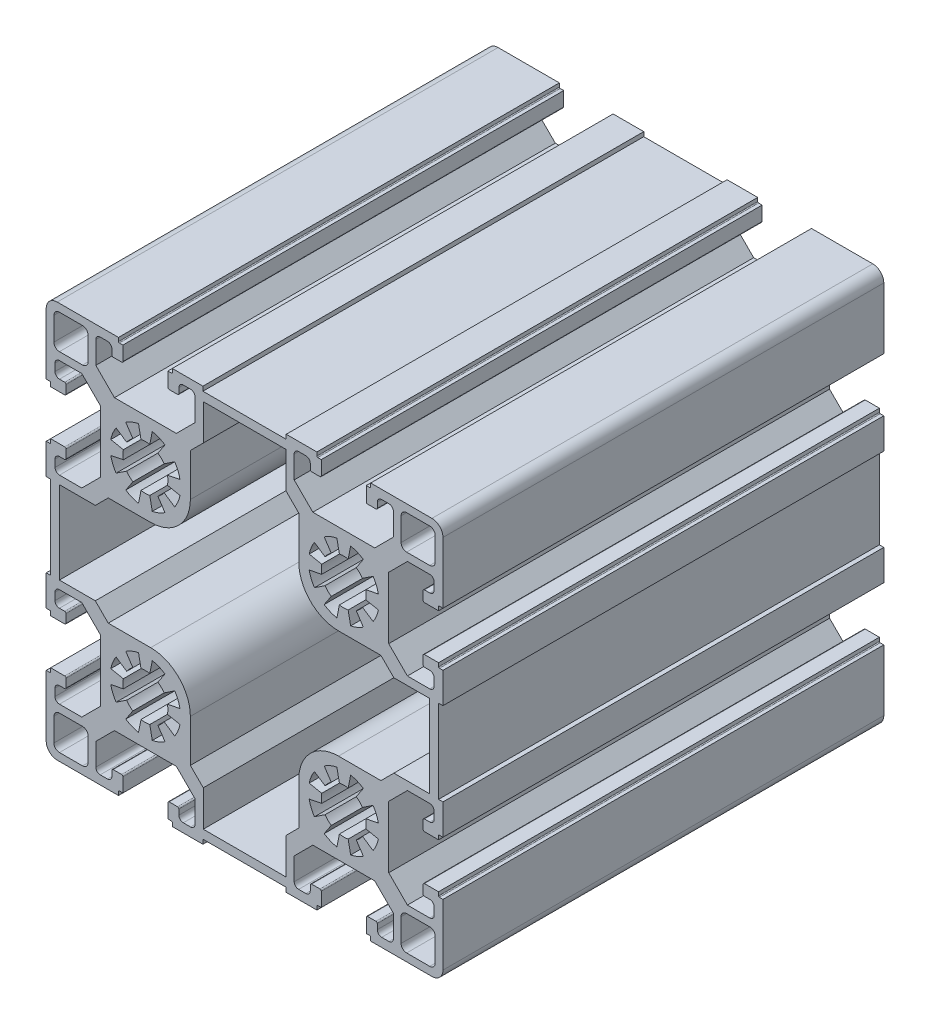
from build123d import *

# Parameters (mm, degrees)
EXTRUDE_1_DEPTH = 100


with BuildPart() as part:
    # 草图1 → 凸台-拉伸1 (new body)
    with BuildSketch(Plane.XY):
        with BuildLine():
            Line((-29.082808051, 43.33457223), (-42.982808051, 43.33457223))
            ThreePointArc((-42.982808051, 43.33457223), (-44.750575003, 42.602339183), (-45.482808051, 40.83457223))
            Line((-45.482808051, 40.83457223), (-45.482808051, 26.93457223))
            Line((-45.482808051, 26.93457223), (-44.682808051, 26.93457223))
            ThreePointArc((-44.682808051, 26.93457223), (-44.541386694, 26.875993586), (-44.482808051, 26.73457223))
            Line((-44.482808051, 26.73457223), (-44.482808051, 25.93457223))
            Line((-44.482808051, 25.93457223), (-41.282808051, 25.93457223))
            ThreePointArc((-41.282808051, 25.93457223), (-41.070676016, 26.022440196), (-40.982808051, 26.23457223))
            Line((-40.982808051, 26.23457223), (-40.982808051, 28.13457223))
            ThreePointArc((-40.982808051, 28.13457223), (-41.070676016, 28.346704264), (-41.282808051, 28.43457223))
            Line((-41.282808051, 28.43457223), (-42.482808051, 28.43457223))
            ThreePointArc((-42.482808051, 28.43457223), (-43.189914832, 28.727465449), (-43.482808051, 29.43457223))
            Line((-43.482808051, 29.43457223), (-43.482808051, 31.08457223))
            ThreePointArc((-43.482808051, 31.08457223), (-43.189914832, 31.791679011), (-42.482808051, 32.08457223))
            Line((-42.482808051, 32.08457223), (-37.414788566, 32.08457223))
            Line((-37.414788566, 32.08457223), (-33.182808051, 27.852591715))
            Line((-33.182808051, 27.852591715), (-33.182808051, 13.816552745))
            Line((-33.182808051, 13.816552745), (-37.414788566, 9.58457223))
            Line((-37.414788566, 9.58457223), (-42.482808051, 9.58457223))
            ThreePointArc((-42.482808051, 9.58457223), (-43.189914832, 9.877465449), (-43.482808051, 10.58457223))
            Line((-43.482808051, 10.58457223), (-43.482808051, 12.23457223))
            ThreePointArc((-43.482808051, 12.23457223), (-43.189914832, 12.941679011), (-42.482808051, 13.23457223))
            Line((-42.482808051, 13.23457223), (-41.282808051, 13.23457223))
            ThreePointArc((-41.282808051, 13.23457223), (-41.070676016, 13.322440196), (-40.982808051, 13.53457223))
            Line((-40.982808051, 13.53457223), (-40.982808051, 15.43457223))
            ThreePointArc((-40.982808051, 15.43457223), (-41.070676016, 15.646704264), (-41.282808051, 15.73457223))
            Line((-41.282808051, 15.73457223), (-44.482808051, 15.73457223))
            Line((-44.482808051, 15.73457223), (-44.482808051, 14.93457223))
            ThreePointArc((-44.482808051, 14.93457223), (-44.541386694, 14.793150874), (-44.682808051, 14.73457223))
            Line((-44.682808051, 14.73457223), (-45.482808051, 14.73457223))
            Line((-45.482808051, 14.73457223), (-45.482808051, 7.78457223))
            Line((-45.482808051, 7.78457223), (-44.482808051, 7.78457223))
            Line((-44.482808051, 7.78457223), (-44.482808051, -11.11542777))
            Line((-44.482808051, -11.11542777), (-45.482808051, -11.11542777))
            Line((-45.482808051, -11.11542777), (-45.482808051, -18.06542777))
            Line((-45.482808051, -18.06542777), (-44.682808051, -18.06542777))
            ThreePointArc((-44.682808051, -18.06542777), (-44.541386694, -18.124006414), (-44.482808051, -18.26542777))
            Line((-44.482808051, -18.26542777), (-44.482808051, -19.06542777))
            Line((-44.482808051, -19.06542777), (-41.282808051, -19.06542777))
            ThreePointArc((-41.282808051, -19.06542777), (-41.070676016, -18.977559804), (-40.982808051, -18.76542777))
            Line((-40.982808051, -18.76542777), (-40.982808051, -16.86542777))
            ThreePointArc((-40.982808051, -16.86542777), (-41.070676016, -16.653295736), (-41.282808051, -16.56542777))
            Line((-41.282808051, -16.56542777), (-42.482808051, -16.56542777))
            ThreePointArc((-42.482808051, -16.56542777), (-43.189914832, -16.272534551), (-43.482808051, -15.56542777))
            Line((-43.482808051, -15.56542777), (-43.482808051, -13.91542777))
            ThreePointArc((-43.482808051, -13.91542777), (-43.189914832, -13.208320989), (-42.482808051, -12.91542777))
            Line((-42.482808051, -12.91542777), (-37.414788566, -12.91542777))
            Line((-37.414788566, -12.91542777), (-33.182808051, -17.147408285))
            Line((-33.182808051, -17.147408285), (-33.182808051, -31.183447255))
            Line((-33.182808051, -31.183447255), (-37.414788566, -35.41542777))
            Line((-37.414788566, -35.41542777), (-42.482808051, -35.41542777))
            ThreePointArc((-42.482808051, -35.41542777), (-43.189914832, -35.122534551), (-43.482808051, -34.41542777))
            Line((-43.482808051, -34.41542777), (-43.482808051, -32.76542777))
            ThreePointArc((-43.482808051, -32.76542777), (-43.189914832, -32.058320989), (-42.482808051, -31.76542777))
            Line((-42.482808051, -31.76542777), (-41.282808051, -31.76542777))
            ThreePointArc((-41.282808051, -31.76542777), (-41.070676016, -31.677559804), (-40.982808051, -31.46542777))
            Line((-40.982808051, -31.46542777), (-40.982808051, -29.56542777))
            ThreePointArc((-40.982808051, -29.56542777), (-41.070676016, -29.353295736), (-41.282808051, -29.26542777))
            Line((-41.282808051, -29.26542777), (-44.482808051, -29.26542777))
            Line((-44.482808051, -29.26542777), (-44.482808051, -30.06542777))
            ThreePointArc((-44.482808051, -30.06542777), (-44.541386694, -30.206849126), (-44.682808051, -30.26542777))
            Line((-44.682808051, -30.26542777), (-45.482808051, -30.26542777))
            Line((-45.482808051, -30.26542777), (-45.482808051, -44.16542777))
            ThreePointArc((-45.482808051, -44.16542777), (-44.750575003, -45.933194723), (-42.982808051, -46.66542777))
            Line((-42.982808051, -46.66542777), (-29.082808051, -46.66542777))
            Line((-29.082808051, -46.66542777), (-29.082808051, -45.86542777))
            ThreePointArc((-29.082808051, -45.86542777), (-29.024229407, -45.724006414), (-28.882808051, -45.66542777))
            Line((-28.882808051, -45.66542777), (-28.082808051, -45.66542777))
            Line((-28.082808051, -45.66542777), (-28.082808051, -42.46542777))
            ThreePointArc((-28.082808051, -42.46542777), (-28.170676016, -42.253295736), (-28.382808051, -42.16542777))
            Line((-28.382808051, -42.16542777), (-30.282808051, -42.16542777))
            ThreePointArc((-30.282808051, -42.16542777), (-30.494940085, -42.253295736), (-30.582808051, -42.46542777))
            Line((-30.582808051, -42.46542777), (-30.582808051, -43.66542777))
            ThreePointArc((-30.582808051, -43.66542777), (-30.875701269, -44.372534551), (-31.582808051, -44.66542777))
            Line((-31.582808051, -44.66542777), (-33.232808051, -44.66542777))
            ThreePointArc((-33.232808051, -44.66542777), (-33.939914832, -44.372534551), (-34.232808051, -43.66542777))
            Line((-34.232808051, -43.66542777), (-34.232808051, -38.597408285))
            Line((-34.232808051, -38.597408285), (-30.000827535, -34.36542777))
            Line((-30.000827535, -34.36542777), (-15.964788566, -34.36542777))
            Line((-15.964788566, -34.36542777), (-11.732808051, -38.597408285))
            Line((-11.732808051, -38.597408285), (-11.732808051, -43.66542777))
            ThreePointArc((-11.732808051, -43.66542777), (-12.025701269, -44.372534551), (-12.732808051, -44.66542777))
            Line((-12.732808051, -44.66542777), (-14.382808051, -44.66542777))
            ThreePointArc((-14.382808051, -44.66542777), (-15.089914832, -44.372534551), (-15.382808051, -43.66542777))
            Line((-15.382808051, -43.66542777), (-15.382808051, -42.46542777))
            ThreePointArc((-15.382808051, -42.46542777), (-15.470676016, -42.253295736), (-15.682808051, -42.16542777))
            Line((-15.682808051, -42.16542777), (-17.582808051, -42.16542777))
            ThreePointArc((-17.582808051, -42.16542777), (-17.794940085, -42.253295736), (-17.882808051, -42.46542777))
            Line((-17.882808051, -42.46542777), (-17.882808051, -45.66542777))
            Line((-17.882808051, -45.66542777), (-17.082808051, -45.66542777))
            ThreePointArc((-17.082808051, -45.66542777), (-16.941386694, -45.724006414), (-16.882808051, -45.86542777))
            Line((-16.882808051, -45.86542777), (-16.882808051, -46.66542777))
            Line((-16.882808051, -46.66542777), (-9.932808051, -46.66542777))
            Line((-9.932808051, -46.66542777), (-9.932808051, -45.66542777))
            Line((-9.932808051, -45.66542777), (8.967191949, -45.66542777))
            Line((8.967191949, -45.66542777), (8.967191949, -46.66542777))
            Line((8.967191949, -46.66542777), (15.917191949, -46.66542777))
            Line((15.917191949, -46.66542777), (15.917191949, -45.86542777))
            ThreePointArc((15.917191949, -45.86542777), (15.975770593, -45.724006414), (16.117191949, -45.66542777))
            Line((16.117191949, -45.66542777), (16.917191949, -45.66542777))
            Line((16.917191949, -45.66542777), (16.917191949, -42.46542777))
            ThreePointArc((16.917191949, -42.46542777), (16.829323984, -42.253295736), (16.617191949, -42.16542777))
            Line((16.617191949, -42.16542777), (14.717191949, -42.16542777))
            ThreePointArc((14.717191949, -42.16542777), (14.505059915, -42.253295736), (14.417191949, -42.46542777))
            Line((14.417191949, -42.46542777), (14.417191949, -43.66542777))
            ThreePointArc((14.417191949, -43.66542777), (14.124298731, -44.372534551), (13.417191949, -44.66542777))
            Line((13.417191949, -44.66542777), (11.767191949, -44.66542777))
            ThreePointArc((11.767191949, -44.66542777), (11.060085168, -44.372534551), (10.767191949, -43.66542777))
            Line((10.767191949, -43.66542777), (10.767191949, -38.597408285))
            Line((10.767191949, -38.597408285), (14.999172465, -34.36542777))
            Line((14.999172465, -34.36542777), (29.035211434, -34.36542777))
            Line((29.035211434, -34.36542777), (33.267191949, -38.597408285))
            Line((33.267191949, -38.597408285), (33.267191949, -43.66542777))
            ThreePointArc((33.267191949, -43.66542777), (32.974298731, -44.372534551), (32.267191949, -44.66542777))
            Line((32.267191949, -44.66542777), (30.617191949, -44.66542777))
            ThreePointArc((30.617191949, -44.66542777), (29.910085168, -44.372534551), (29.617191949, -43.66542777))
            Line((29.617191949, -43.66542777), (29.617191949, -42.46542777))
            ThreePointArc((29.617191949, -42.46542777), (29.529323984, -42.253295736), (29.317191949, -42.16542777))
            Line((29.317191949, -42.16542777), (27.417191949, -42.16542777))
            ThreePointArc((27.417191949, -42.16542777), (27.205059915, -42.253295736), (27.117191949, -42.46542777))
            Line((27.117191949, -42.46542777), (27.117191949, -45.66542777))
            Line((27.117191949, -45.66542777), (27.917191949, -45.66542777))
            ThreePointArc((27.917191949, -45.66542777), (28.058613306, -45.724006414), (28.117191949, -45.86542777))
            Line((28.117191949, -45.86542777), (28.117191949, -46.66542777))
            Line((28.117191949, -46.66542777), (42.017191949, -46.66542777))
            ThreePointArc((42.017191949, -46.66542777), (43.784958902, -45.933194723), (44.517191949, -44.16542777))
            Line((44.517191949, -44.16542777), (44.517191949, -30.26542777))
            Line((44.517191949, -30.26542777), (43.717191949, -30.26542777))
            ThreePointArc((43.717191949, -30.26542777), (43.575770593, -30.206849126), (43.517191949, -30.06542777))
            Line((43.517191949, -30.06542777), (43.517191949, -29.26542777))
            Line((43.517191949, -29.26542777), (40.317191949, -29.26542777))
            ThreePointArc((40.317191949, -29.26542777), (40.105059915, -29.353295736), (40.017191949, -29.56542777))
            Line((40.017191949, -29.56542777), (40.017191949, -31.46542777))
            ThreePointArc((40.017191949, -31.46542777), (40.105059915, -31.677559804), (40.317191949, -31.76542777))
            Line((40.317191949, -31.76542777), (41.517191949, -31.76542777))
            ThreePointArc((41.517191949, -31.76542777), (42.224298731, -32.058320989), (42.517191949, -32.76542777))
            Line((42.517191949, -32.76542777), (42.517191949, -34.41542777))
            ThreePointArc((42.517191949, -34.41542777), (42.224298731, -35.122534551), (41.517191949, -35.41542777))
            Line((41.517191949, -35.41542777), (36.449172465, -35.41542777))
            Line((36.449172465, -35.41542777), (32.217191949, -31.183447255))
            Line((32.217191949, -31.183447255), (32.217191949, -17.147408285))
            Line((32.217191949, -17.147408285), (36.449172465, -12.91542777))
            Line((36.449172465, -12.91542777), (41.517191949, -12.91542777))
            ThreePointArc((41.517191949, -12.91542777), (42.224298731, -13.208320989), (42.517191949, -13.91542777))
            Line((42.517191949, -13.91542777), (42.517191949, -15.56542777))
            ThreePointArc((42.517191949, -15.56542777), (42.224298731, -16.272534551), (41.517191949, -16.56542777))
            Line((41.517191949, -16.56542777), (40.317191949, -16.56542777))
            ThreePointArc((40.317191949, -16.56542777), (40.105059915, -16.653295736), (40.017191949, -16.86542777))
            Line((40.017191949, -16.86542777), (40.017191949, -18.76542777))
            ThreePointArc((40.017191949, -18.76542777), (40.105059915, -18.977559804), (40.317191949, -19.06542777))
            Line((40.317191949, -19.06542777), (43.517191949, -19.06542777))
            Line((43.517191949, -19.06542777), (43.517191949, -18.26542777))
            ThreePointArc((43.517191949, -18.26542777), (43.575770593, -18.124006414), (43.717191949, -18.06542777))
            Line((43.717191949, -18.06542777), (44.517191949, -18.06542777))
            Line((44.517191949, -18.06542777), (44.517191949, -11.11542777))
            Line((44.517191949, -11.11542777), (43.517191949, -11.11542777))
            Line((43.517191949, -11.11542777), (43.517191949, 7.78457223))
            Line((43.517191949, 7.78457223), (44.517191949, 7.78457223))
            Line((44.517191949, 7.78457223), (44.517191949, 14.73457223))
            Line((44.517191949, 14.73457223), (43.717191949, 14.73457223))
            ThreePointArc((43.717191949, 14.73457223), (43.575770593, 14.793150874), (43.517191949, 14.93457223))
            Line((43.517191949, 14.93457223), (43.517191949, 15.73457223))
            Line((43.517191949, 15.73457223), (40.317191949, 15.73457223))
            ThreePointArc((40.317191949, 15.73457223), (40.105059915, 15.646704264), (40.017191949, 15.43457223))
            Line((40.017191949, 15.43457223), (40.017191949, 13.53457223))
            ThreePointArc((40.017191949, 13.53457223), (40.105059915, 13.322440196), (40.317191949, 13.23457223))
            Line((40.317191949, 13.23457223), (41.517191949, 13.23457223))
            ThreePointArc((41.517191949, 13.23457223), (42.224298731, 12.941679011), (42.517191949, 12.23457223))
            Line((42.517191949, 12.23457223), (42.517191949, 10.58457223))
            ThreePointArc((42.517191949, 10.58457223), (42.224298731, 9.877465449), (41.517191949, 9.58457223))
            Line((41.517191949, 9.58457223), (36.449172465, 9.58457223))
            Line((36.449172465, 9.58457223), (32.217191949, 13.816552745))
            Line((32.217191949, 13.816552745), (32.217191949, 27.852591715))
            Line((32.217191949, 27.852591715), (36.449172465, 32.08457223))
            Line((36.449172465, 32.08457223), (41.517191949, 32.08457223))
            ThreePointArc((41.517191949, 32.08457223), (42.224298731, 31.791679011), (42.517191949, 31.08457223))
            Line((42.517191949, 31.08457223), (42.517191949, 29.43457223))
            ThreePointArc((42.517191949, 29.43457223), (42.224298731, 28.727465449), (41.517191949, 28.43457223))
            Line((41.517191949, 28.43457223), (40.317191949, 28.43457223))
            ThreePointArc((40.317191949, 28.43457223), (40.105059915, 28.346704264), (40.017191949, 28.13457223))
            Line((40.017191949, 28.13457223), (40.017191949, 26.23457223))
            ThreePointArc((40.017191949, 26.23457223), (40.105059915, 26.022440196), (40.317191949, 25.93457223))
            Line((40.317191949, 25.93457223), (43.517191949, 25.93457223))
            Line((43.517191949, 25.93457223), (43.517191949, 26.73457223))
            ThreePointArc((43.517191949, 26.73457223), (43.575770593, 26.875993586), (43.717191949, 26.93457223))
            Line((43.717191949, 26.93457223), (44.517191949, 26.93457223))
            Line((44.517191949, 26.93457223), (44.517191949, 40.83457223))
            ThreePointArc((44.517191949, 40.83457223), (43.784958902, 42.602339183), (42.017191949, 43.33457223))
            Line((42.017191949, 43.33457223), (28.117191949, 43.33457223))
            Line((28.117191949, 43.33457223), (28.117191949, 42.53457223))
            ThreePointArc((28.117191949, 42.53457223), (28.058613306, 42.393150874), (27.917191949, 42.33457223))
            Line((27.917191949, 42.33457223), (27.117191949, 42.33457223))
            Line((27.117191949, 42.33457223), (27.117191949, 39.13457223))
            ThreePointArc((27.117191949, 39.13457223), (27.205059915, 38.922440196), (27.417191949, 38.83457223))
            Line((27.417191949, 38.83457223), (29.317191949, 38.83457223))
            ThreePointArc((29.317191949, 38.83457223), (29.529323984, 38.922440196), (29.617191949, 39.13457223))
            Line((29.617191949, 39.13457223), (29.617191949, 40.33457223))
            ThreePointArc((29.617191949, 40.33457223), (29.910085168, 41.041679011), (30.617191949, 41.33457223))
            Line((30.617191949, 41.33457223), (32.267191949, 41.33457223))
            ThreePointArc((32.267191949, 41.33457223), (32.974298731, 41.041679011), (33.267191949, 40.33457223))
            Line((33.267191949, 40.33457223), (33.267191949, 35.266552745))
            Line((33.267191949, 35.266552745), (29.035211434, 31.03457223))
            Line((29.035211434, 31.03457223), (14.999172465, 31.03457223))
            Line((14.999172465, 31.03457223), (10.767191949, 35.266552745))
            Line((10.767191949, 35.266552745), (10.767191949, 40.33457223))
            ThreePointArc((10.767191949, 40.33457223), (11.060085168, 41.041679011), (11.767191949, 41.33457223))
            Line((11.767191949, 41.33457223), (13.417191949, 41.33457223))
            ThreePointArc((13.417191949, 41.33457223), (14.124298731, 41.041679011), (14.417191949, 40.33457223))
            Line((14.417191949, 40.33457223), (14.417191949, 39.13457223))
            ThreePointArc((14.417191949, 39.13457223), (14.505059915, 38.922440196), (14.717191949, 38.83457223))
            Line((14.717191949, 38.83457223), (16.617191949, 38.83457223))
            ThreePointArc((16.617191949, 38.83457223), (16.829323984, 38.922440196), (16.917191949, 39.13457223))
            Line((16.917191949, 39.13457223), (16.917191949, 42.33457223))
            Line((16.917191949, 42.33457223), (16.117191949, 42.33457223))
            ThreePointArc((16.117191949, 42.33457223), (15.975770593, 42.393150874), (15.917191949, 42.53457223))
            Line((15.917191949, 42.53457223), (15.917191949, 43.33457223))
            Line((15.917191949, 43.33457223), (8.967191949, 43.33457223))
            Line((8.967191949, 43.33457223), (8.967191949, 42.33457223))
            Line((8.967191949, 42.33457223), (-9.932808051, 42.33457223))
            Line((-9.932808051, 42.33457223), (-9.932808051, 43.33457223))
            Line((-9.932808051, 43.33457223), (-16.882808051, 43.33457223))
            Line((-16.882808051, 43.33457223), (-16.882808051, 42.53457223))
            ThreePointArc((-16.882808051, 42.53457223), (-16.941386694, 42.393150874), (-17.082808051, 42.33457223))
            Line((-17.082808051, 42.33457223), (-17.882808051, 42.33457223))
            Line((-17.882808051, 42.33457223), (-17.882808051, 39.13457223))
            ThreePointArc((-17.882808051, 39.13457223), (-17.794940085, 38.922440196), (-17.582808051, 38.83457223))
            Line((-17.582808051, 38.83457223), (-15.682808051, 38.83457223))
            ThreePointArc((-15.682808051, 38.83457223), (-15.470676016, 38.922440196), (-15.382808051, 39.13457223))
            Line((-15.382808051, 39.13457223), (-15.382808051, 40.33457223))
            ThreePointArc((-15.382808051, 40.33457223), (-15.089914832, 41.041679011), (-14.382808051, 41.33457223))
            Line((-14.382808051, 41.33457223), (-12.732808051, 41.33457223))
            ThreePointArc((-12.732808051, 41.33457223), (-12.025701269, 41.041679011), (-11.732808051, 40.33457223))
            Line((-11.732808051, 40.33457223), (-11.732808051, 35.266552745))
            Line((-11.732808051, 35.266552745), (-15.964788566, 31.03457223))
            Line((-15.964788566, 31.03457223), (-30.000827535, 31.03457223))
            Line((-30.000827535, 31.03457223), (-34.232808051, 35.266552745))
            Line((-34.232808051, 35.266552745), (-34.232808051, 40.33457223))
            ThreePointArc((-34.232808051, 40.33457223), (-33.939914832, 41.041679011), (-33.232808051, 41.33457223))
            Line((-33.232808051, 41.33457223), (-31.582808051, 41.33457223))
            ThreePointArc((-31.582808051, 41.33457223), (-30.875701269, 41.041679011), (-30.582808051, 40.33457223))
            Line((-30.582808051, 40.33457223), (-30.582808051, 39.13457223))
            ThreePointArc((-30.582808051, 39.13457223), (-30.494940085, 38.922440196), (-30.282808051, 38.83457223))
            Line((-30.282808051, 38.83457223), (-28.382808051, 38.83457223))
            ThreePointArc((-28.382808051, 38.83457223), (-28.170676016, 38.922440196), (-28.082808051, 39.13457223))
            Line((-28.082808051, 39.13457223), (-28.082808051, 42.33457223))
            Line((-28.082808051, 42.33457223), (-28.882808051, 42.33457223))
            ThreePointArc((-28.882808051, 42.33457223), (-29.024229407, 42.393150874), (-29.082808051, 42.53457223))
            Line((-29.082808051, 42.53457223), (-29.082808051, 43.33457223))
        make_face()
        with BuildLine():
            Line((-42.482808051, 33.83457223), (-37.232808051, 33.83457223))
            ThreePointArc((-37.232808051, 33.83457223), (-36.348924574, 34.200688754), (-35.982808051, 35.08457223))
            Line((-35.982808051, 35.08457223), (-35.982808051, 40.33457223))
            ThreePointArc((-35.982808051, 40.33457223), (-36.348924574, 41.218455706), (-37.232808051, 41.58457223))
            Line((-37.232808051, 41.58457223), (-42.482808051, 41.58457223))
            ThreePointArc((-42.482808051, 41.58457223), (-43.366691527, 41.218455706), (-43.732808051, 40.33457223))
            Line((-43.732808051, 40.33457223), (-43.732808051, 35.08457223))
            ThreePointArc((-43.732808051, 35.08457223), (-43.366691527, 34.200688754), (-42.482808051, 33.83457223))
        make_face(mode=Mode.SUBTRACT)
        with BuildLine():
            Line((-27.427369915, 14.182815332), (-25.816216239, 16.594077207))
            ThreePointArc((-25.816216239, 16.594077207), (-26.589052635, 17.228327646), (-27.223303073, 18.001164042))
            Line((-27.223303073, 18.001164042), (-29.634564949, 16.390010366))
            ThreePointArc((-29.634564949, 16.390010366), (-30.373844311, 17.773104771), (-30.829090294, 19.273849654))
            Line((-30.829090294, 19.273849654), (-27.984812981, 19.839611588))
            ThreePointArc((-27.984812981, 19.839611588), (-28.082808051, 20.83457223), (-27.984812981, 21.829532872))
            Line((-27.984812981, 21.829532872), (-30.829090294, 22.395294806))
            ThreePointArc((-30.829090294, 22.395294806), (-30.373844311, 23.896039689), (-29.634564949, 25.279134094))
            Line((-29.634564949, 25.279134094), (-27.223303073, 23.667980418))
            ThreePointArc((-27.223303073, 23.667980418), (-26.589052635, 24.440816814), (-25.816216239, 25.075067253))
            Line((-25.816216239, 25.075067253), (-27.427369915, 27.486329128))
            ThreePointArc((-27.427369915, 27.486329128), (-26.044275509, 28.22560849), (-24.543530627, 28.680854473))
            Line((-24.543530627, 28.680854473), (-23.977768693, 25.83657716))
            ThreePointArc((-23.977768693, 25.83657716), (-22.982808051, 25.93457223), (-21.987847408, 25.83657716))
            Line((-21.987847408, 25.83657716), (-21.422085474, 28.680854473))
            ThreePointArc((-21.422085474, 28.680854473), (-19.921340592, 28.22560849), (-18.538246186, 27.486329128))
            Line((-18.538246186, 27.486329128), (-20.149399862, 25.075067253))
            ThreePointArc((-20.149399862, 25.075067253), (-19.376563466, 24.440816814), (-18.742313028, 23.667980418))
            Line((-18.742313028, 23.667980418), (-16.331051152, 25.279134094))
            ThreePointArc((-16.331051152, 25.279134094), (-15.59177179, 23.896039689), (-15.136525807, 22.395294806))
            Line((-15.136525807, 22.395294806), (-17.98080312, 21.829532872))
            ThreePointArc((-17.98080312, 21.829532872), (-17.882808051, 20.83457223), (-17.98080312, 19.839611588))
            Line((-17.98080312, 19.839611588), (-15.136525807, 19.273849654))
            ThreePointArc((-15.136525807, 19.273849654), (-15.59177179, 17.773104771), (-16.331051152, 16.390010366))
            Line((-16.331051152, 16.390010366), (-18.742313028, 18.001164042))
            ThreePointArc((-18.742313028, 18.001164042), (-19.376563466, 17.228327646), (-20.149399862, 16.594077207))
            Line((-20.149399862, 16.594077207), (-18.538246186, 14.182815332))
            ThreePointArc((-18.538246186, 14.182815332), (-19.921340592, 13.44353597), (-21.422085474, 12.988289987))
            Line((-21.422085474, 12.988289987), (-21.987847408, 15.8325673))
            ThreePointArc((-21.987847408, 15.8325673), (-22.982808051, 15.73457223), (-23.977768693, 15.8325673))
            Line((-23.977768693, 15.8325673), (-24.543530627, 12.988289987))
            ThreePointArc((-24.543530627, 12.988289987), (-26.044275509, 13.44353597), (-27.427369915, 14.182815332))
        make_face(mode=Mode.SUBTRACT)
        with BuildLine():
            Line((41.517191949, 33.83457223), (36.267191949, 33.83457223))
            ThreePointArc((36.267191949, 33.83457223), (35.383308473, 34.200688754), (35.017191949, 35.08457223))
            Line((35.017191949, 35.08457223), (35.017191949, 40.33457223))
            ThreePointArc((35.017191949, 40.33457223), (35.383308473, 41.218455706), (36.267191949, 41.58457223))
            Line((36.267191949, 41.58457223), (41.517191949, 41.58457223))
            ThreePointArc((41.517191949, 41.58457223), (42.401075426, 41.218455706), (42.767191949, 40.33457223))
            Line((42.767191949, 40.33457223), (42.767191949, 35.08457223))
            ThreePointArc((42.767191949, 35.08457223), (42.401075426, 34.200688754), (41.517191949, 33.83457223))
        make_face(mode=Mode.SUBTRACT)
        with BuildLine():
            Line((17.572630085, 14.182815332), (19.183783761, 16.594077207))
            ThreePointArc((19.183783761, 16.594077207), (18.410947365, 17.228327646), (17.776696927, 18.001164042))
            Line((17.776696927, 18.001164042), (15.365435051, 16.390010366))
            ThreePointArc((15.365435051, 16.390010366), (14.626155689, 17.773104771), (14.170909706, 19.273849654))
            Line((14.170909706, 19.273849654), (17.015187019, 19.839611588))
            ThreePointArc((17.015187019, 19.839611588), (16.917191949, 20.83457223), (17.015187019, 21.829532872))
            Line((17.015187019, 21.829532872), (14.170909706, 22.395294806))
            ThreePointArc((14.170909706, 22.395294806), (14.626155689, 23.896039689), (15.365435051, 25.279134094))
            Line((15.365435051, 25.279134094), (17.776696927, 23.667980418))
            ThreePointArc((17.776696927, 23.667980418), (18.410947365, 24.440816814), (19.183783761, 25.075067253))
            Line((19.183783761, 25.075067253), (17.572630085, 27.486329128))
            ThreePointArc((17.572630085, 27.486329128), (18.955724491, 28.22560849), (20.456469373, 28.680854473))
            Line((20.456469373, 28.680854473), (21.022231307, 25.83657716))
            ThreePointArc((21.022231307, 25.83657716), (22.017191949, 25.93457223), (23.012152592, 25.83657716))
            Line((23.012152592, 25.83657716), (23.577914526, 28.680854473))
            ThreePointArc((23.577914526, 28.680854473), (25.078659408, 28.22560849), (26.461753814, 27.486329128))
            Line((26.461753814, 27.486329128), (24.850600138, 25.075067253))
            ThreePointArc((24.850600138, 25.075067253), (25.623436534, 24.440816814), (26.257686972, 23.667980418))
            Line((26.257686972, 23.667980418), (28.668948848, 25.279134094))
            ThreePointArc((28.668948848, 25.279134094), (29.40822821, 23.896039689), (29.863474193, 22.395294806))
            Line((29.863474193, 22.395294806), (27.01919688, 21.829532872))
            ThreePointArc((27.01919688, 21.829532872), (27.117191949, 20.83457223), (27.01919688, 19.839611588))
            Line((27.01919688, 19.839611588), (29.863474193, 19.273849654))
            ThreePointArc((29.863474193, 19.273849654), (29.40822821, 17.773104771), (28.668948848, 16.390010366))
            Line((28.668948848, 16.390010366), (26.257686972, 18.001164042))
            ThreePointArc((26.257686972, 18.001164042), (25.623436534, 17.228327646), (24.850600138, 16.594077207))
            Line((24.850600138, 16.594077207), (26.461753814, 14.182815332))
            ThreePointArc((26.461753814, 14.182815332), (25.078659408, 13.44353597), (23.577914526, 12.988289987))
            Line((23.577914526, 12.988289987), (23.012152592, 15.8325673))
            ThreePointArc((23.012152592, 15.8325673), (22.017191949, 15.73457223), (21.022231307, 15.8325673))
            Line((21.022231307, 15.8325673), (20.456469373, 12.988289987))
            ThreePointArc((20.456469373, 12.988289987), (18.955724491, 13.44353597), (17.572630085, 14.182815332))
        make_face(mode=Mode.SUBTRACT)
        with BuildLine():
            Line((-9.853442847, 40.33457223), (8.887826745, 40.33457223))
            Line((8.887826745, 40.33457223), (8.887826745, 32.196170481))
            Line((8.887826745, 32.196170481), (11.817191949, 29.266805277))
            Line((11.817191949, 29.266805277), (11.817191949, 19.63457223))
            ThreePointArc((11.817191949, 19.63457223), (14.453230919, 13.270611199), (20.817191949, 10.63457223))
            Line((20.817191949, 10.63457223), (30.449424997, 10.63457223))
            Line((30.449424997, 10.63457223), (33.3787902, 7.705207026))
            Line((33.3787902, 7.705207026), (41.517191949, 7.705207026))
            Line((41.517191949, 7.705207026), (41.517191949, -11.036062566))
            Line((41.517191949, -11.036062566), (33.3787902, -11.036062566))
            Line((33.3787902, -11.036062566), (30.449424997, -13.96542777))
            Line((30.449424997, -13.96542777), (20.817191949, -13.96542777))
            ThreePointArc((20.817191949, -13.96542777), (14.453230919, -16.601466739), (11.817191949, -22.96542777))
            Line((11.817191949, -22.96542777), (11.817191949, -32.597660817))
            Line((11.817191949, -32.597660817), (8.887826746, -35.527026021))
            Line((8.887826746, -35.527026021), (8.887826746, -43.66542777))
            Line((8.887826746, -43.66542777), (-9.853442847, -43.66542777))
            Line((-9.853442847, -43.66542777), (-9.853442847, -35.527026021))
            Line((-9.853442847, -35.527026021), (-12.782808051, -32.597660817))
            Line((-12.782808051, -32.597660817), (-12.782808051, -22.96542777))
            ThreePointArc((-12.782808051, -22.96542777), (-15.41884702, -16.601466739), (-21.782808051, -13.96542777))
            Line((-21.782808051, -13.96542777), (-31.415041098, -13.96542777))
            Line((-31.415041098, -13.96542777), (-34.344406302, -11.036062566))
            Line((-34.344406302, -11.036062566), (-42.482808051, -11.036062566))
            Line((-42.482808051, -11.036062566), (-42.482808051, 7.705207026))
            Line((-42.482808051, 7.705207026), (-34.344406302, 7.705207026))
            Line((-34.344406302, 7.705207026), (-31.415041098, 10.63457223))
            Line((-31.415041098, 10.63457223), (-21.782808051, 10.63457223))
            ThreePointArc((-21.782808051, 10.63457223), (-15.41884702, 13.270611199), (-12.782808051, 19.63457223))
            Line((-12.782808051, 19.63457223), (-12.782808051, 29.266805277))
            Line((-12.782808051, 29.266805277), (-9.853442847, 32.196170481))
            Line((-9.853442847, 32.196170481), (-9.853442847, 40.33457223))
        make_face(mode=Mode.SUBTRACT)
        with BuildLine():
            Line((-42.482808051, -37.16542777), (-37.232808051, -37.16542777))
            ThreePointArc((-37.232808051, -37.16542777), (-36.348924574, -37.531544294), (-35.982808051, -38.41542777))
            Line((-35.982808051, -38.41542777), (-35.982808051, -43.66542777))
            ThreePointArc((-35.982808051, -43.66542777), (-36.348924574, -44.549311246), (-37.232808051, -44.91542777))
            Line((-37.232808051, -44.91542777), (-42.482808051, -44.91542777))
            ThreePointArc((-42.482808051, -44.91542777), (-43.366691527, -44.549311246), (-43.732808051, -43.66542777))
            Line((-43.732808051, -43.66542777), (-43.732808051, -38.41542777))
            ThreePointArc((-43.732808051, -38.41542777), (-43.366691527, -37.531544294), (-42.482808051, -37.16542777))
        make_face(mode=Mode.SUBTRACT)
        with BuildLine():
            Line((-27.427369915, -17.513670872), (-25.816216239, -19.924932747))
            ThreePointArc((-25.816216239, -19.924932747), (-26.589052635, -20.559183186), (-27.223303073, -21.332019582))
            Line((-27.223303073, -21.332019582), (-29.634564949, -19.720865906))
            ThreePointArc((-29.634564949, -19.720865906), (-30.373844311, -21.103960311), (-30.829090294, -22.604705194))
            Line((-30.829090294, -22.604705194), (-27.984812981, -23.170467128))
            ThreePointArc((-27.984812981, -23.170467128), (-28.082808051, -24.16542777), (-27.984812981, -25.160388412))
            Line((-27.984812981, -25.160388412), (-30.829090294, -25.726150346))
            ThreePointArc((-30.829090294, -25.726150346), (-30.373844311, -27.226895229), (-29.634564949, -28.609989634))
            Line((-29.634564949, -28.609989634), (-27.223303073, -26.998835958))
            ThreePointArc((-27.223303073, -26.998835958), (-26.589052635, -27.771672354), (-25.816216239, -28.405922793))
            Line((-25.816216239, -28.405922793), (-27.427369915, -30.817184668))
            ThreePointArc((-27.427369915, -30.817184668), (-26.044275509, -31.55646403), (-24.543530627, -32.011710013))
            Line((-24.543530627, -32.011710013), (-23.977768693, -29.1674327))
            ThreePointArc((-23.977768693, -29.1674327), (-22.982808051, -29.26542777), (-21.987847408, -29.1674327))
            Line((-21.987847408, -29.1674327), (-21.422085474, -32.011710013))
            ThreePointArc((-21.422085474, -32.011710013), (-19.921340592, -31.55646403), (-18.538246186, -30.817184668))
            Line((-18.538246186, -30.817184668), (-20.149399862, -28.405922793))
            ThreePointArc((-20.149399862, -28.405922793), (-19.376563466, -27.771672354), (-18.742313028, -26.998835958))
            Line((-18.742313028, -26.998835958), (-16.331051152, -28.609989634))
            ThreePointArc((-16.331051152, -28.609989634), (-15.59177179, -27.226895229), (-15.136525807, -25.726150346))
            Line((-15.136525807, -25.726150346), (-17.98080312, -25.160388412))
            ThreePointArc((-17.98080312, -25.160388412), (-17.882808051, -24.16542777), (-17.98080312, -23.170467128))
            Line((-17.98080312, -23.170467128), (-15.136525807, -22.604705194))
            ThreePointArc((-15.136525807, -22.604705194), (-15.59177179, -21.103960311), (-16.331051152, -19.720865906))
            Line((-16.331051152, -19.720865906), (-18.742313028, -21.332019582))
            ThreePointArc((-18.742313028, -21.332019582), (-19.376563466, -20.559183186), (-20.149399862, -19.924932747))
            Line((-20.149399862, -19.924932747), (-18.538246186, -17.513670872))
            ThreePointArc((-18.538246186, -17.513670872), (-19.921340592, -16.77439151), (-21.422085474, -16.319145527))
            Line((-21.422085474, -16.319145527), (-21.987847408, -19.16342284))
            ThreePointArc((-21.987847408, -19.16342284), (-22.982808051, -19.06542777), (-23.977768693, -19.16342284))
            Line((-23.977768693, -19.16342284), (-24.543530627, -16.319145527))
            ThreePointArc((-24.543530627, -16.319145527), (-26.044275509, -16.77439151), (-27.427369915, -17.513670872))
        make_face(mode=Mode.SUBTRACT)
        with BuildLine():
            Line((41.517191949, -37.16542777), (36.267191949, -37.16542777))
            ThreePointArc((36.267191949, -37.16542777), (35.383308473, -37.531544294), (35.017191949, -38.41542777))
            Line((35.017191949, -38.41542777), (35.017191949, -43.66542777))
            ThreePointArc((35.017191949, -43.66542777), (35.383308473, -44.549311246), (36.267191949, -44.91542777))
            Line((36.267191949, -44.91542777), (41.517191949, -44.91542777))
            ThreePointArc((41.517191949, -44.91542777), (42.401075426, -44.549311246), (42.767191949, -43.66542777))
            Line((42.767191949, -43.66542777), (42.767191949, -38.41542777))
            ThreePointArc((42.767191949, -38.41542777), (42.401075426, -37.531544294), (41.517191949, -37.16542777))
        make_face(mode=Mode.SUBTRACT)
        with BuildLine():
            Line((17.572630085, -17.513670872), (19.183783761, -19.924932747))
            ThreePointArc((19.183783761, -19.924932747), (18.410947365, -20.559183186), (17.776696927, -21.332019582))
            Line((17.776696927, -21.332019582), (15.365435051, -19.720865906))
            ThreePointArc((15.365435051, -19.720865906), (14.626155689, -21.103960311), (14.170909706, -22.604705194))
            Line((14.170909706, -22.604705194), (17.015187019, -23.170467128))
            ThreePointArc((17.015187019, -23.170467128), (16.917191949, -24.16542777), (17.015187019, -25.160388412))
            Line((17.015187019, -25.160388412), (14.170909706, -25.726150346))
            ThreePointArc((14.170909706, -25.726150346), (14.626155689, -27.226895229), (15.365435051, -28.609989634))
            Line((15.365435051, -28.609989634), (17.776696927, -26.998835958))
            ThreePointArc((17.776696927, -26.998835958), (18.410947365, -27.771672354), (19.183783761, -28.405922793))
            Line((19.183783761, -28.405922793), (17.572630085, -30.817184668))
            ThreePointArc((17.572630085, -30.817184668), (18.955724491, -31.55646403), (20.456469373, -32.011710013))
            Line((20.456469373, -32.011710013), (21.022231307, -29.1674327))
            ThreePointArc((21.022231307, -29.1674327), (22.017191949, -29.26542777), (23.012152592, -29.1674327))
            Line((23.012152592, -29.1674327), (23.577914526, -32.011710013))
            ThreePointArc((23.577914526, -32.011710013), (25.078659408, -31.55646403), (26.461753814, -30.817184668))
            Line((26.461753814, -30.817184668), (24.850600138, -28.405922793))
            ThreePointArc((24.850600138, -28.405922793), (25.623436534, -27.771672354), (26.257686972, -26.998835958))
            Line((26.257686972, -26.998835958), (28.668948848, -28.609989634))
            ThreePointArc((28.668948848, -28.609989634), (29.40822821, -27.226895229), (29.863474193, -25.726150346))
            Line((29.863474193, -25.726150346), (27.01919688, -25.160388412))
            ThreePointArc((27.01919688, -25.160388412), (27.117191949, -24.16542777), (27.01919688, -23.170467128))
            Line((27.01919688, -23.170467128), (29.863474193, -22.604705194))
            ThreePointArc((29.863474193, -22.604705194), (29.40822821, -21.103960311), (28.668948848, -19.720865906))
            Line((28.668948848, -19.720865906), (26.257686972, -21.332019582))
            ThreePointArc((26.257686972, -21.332019582), (25.623436534, -20.559183186), (24.850600138, -19.924932747))
            Line((24.850600138, -19.924932747), (26.461753814, -17.513670872))
            ThreePointArc((26.461753814, -17.513670872), (25.078659408, -16.77439151), (23.577914526, -16.319145527))
            Line((23.577914526, -16.319145527), (23.012152592, -19.16342284))
            ThreePointArc((23.012152592, -19.16342284), (22.017191949, -19.06542777), (21.022231307, -19.16342284))
            Line((21.022231307, -19.16342284), (20.456469373, -16.319145527))
            ThreePointArc((20.456469373, -16.319145527), (18.955724491, -16.77439151), (17.572630085, -17.513670872))
        make_face(mode=Mode.SUBTRACT)
    extrude(amount=EXTRUDE_1_DEPTH)


solid = part.part
